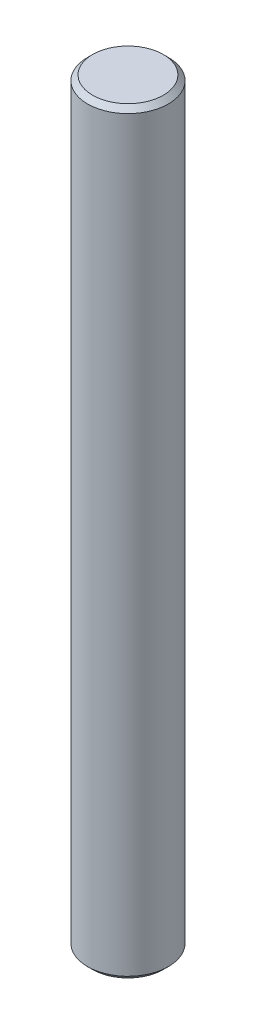
from build123d import *

# Parameters (mm, degrees)
SKETCH1_R           = 4
BOSS_EXTRUDE1_DEPTH = 37.5
CHAMFER1_SIZE       = 0.5


with BuildPart() as part:
    # Sketch1 → Boss-Extrude1 (new, symmetric)
    with BuildSketch(Plane(origin=(0, 0, 0), x_dir=(1, 0, 0), z_dir=(0, 1, 0))):
        with Locations(Location((0, 0, 0), (0, 0, 270))):
            Circle(SKETCH1_R)
    extrude(amount=BOSS_EXTRUDE1_DEPTH, both=True)

    # Chamfer1
    chamfer1_edges = [part.edges().sort_by_distance(p)[0] for p in [
        (0, -37.5, -4),
        (0, 37.5, -4),
    ]]
    chamfer(chamfer1_edges, length=CHAMFER1_SIZE)


solid = part.part
